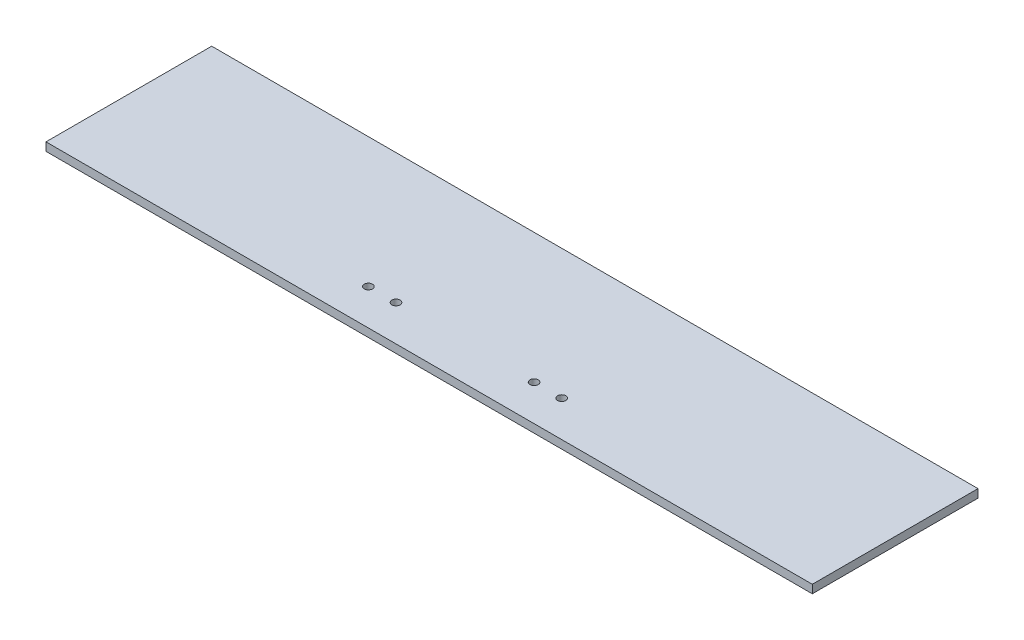
from build123d import *

# Parameters (mm, degrees)
SKETCH1_W               = 277.5
SKETCH1_H               = 60
BOSS_EXTRUDE1_DEPTH     = 3
CUT_EXTRUDE1_DEPTH      = 142.987895611
CUT_EXTRUDE1_DEPTH_BACK = 142.987895611
SKETCH3_R               = 1.5


with BuildPart() as part:
    # Sketch1 → Boss-Extrude1 (new body)
    with BuildSketch(Plane(origin=(0, 0, 0), x_dir=(1, 0, 0), z_dir=(0, 1, 0))):
        Rectangle(SKETCH1_W, SKETCH1_H)
    extrude(amount=BOSS_EXTRUDE1_DEPTH)

    # Sketch3 → Cut-Extrude1 (cut, two sides: drawn at the far end of the back side and taken through both)
    with BuildSketch(Plane(origin=(0, 3, 0), x_dir=(1, 0, 0), z_dir=(0, 1, 0)).offset(-CUT_EXTRUDE1_DEPTH_BACK)):
        with Locations(Location((25, -17, 0), (0, 0, 270))):
            Circle(SKETCH3_R)
        with Locations(Location((35, -17, 0), (0, 0, 270))):
            Circle(SKETCH3_R)
        with Locations(Location((-35, -17, 0), (0, 0, 90))):
            Circle(SKETCH3_R)
        with Locations(Location((-25, -17, 0), (0, 0, 90))):
            Circle(SKETCH3_R)
    extrude(amount=CUT_EXTRUDE1_DEPTH + CUT_EXTRUDE1_DEPTH_BACK, mode=Mode.SUBTRACT)


solid = part.part
